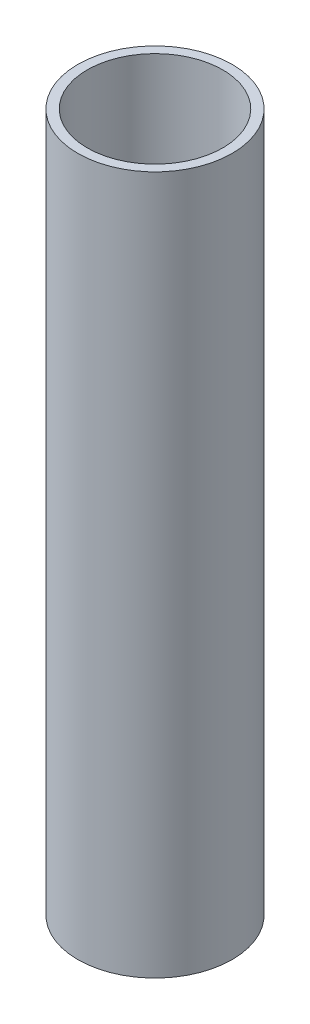
from build123d import *

# Parameters (mm, degrees)
SKETCH1_R           = 11.05
SKETCH1_R_2         = 9.7
BOSS_EXTRUDE1_DEPTH = 100


with BuildPart() as part:
    # Sketch1 → Boss-Extrude1 (new body)
    with BuildSketch(Plane(origin=(0, 0, 0), x_dir=(1, 0, 0), z_dir=(0, 1, 0))):
        with Locations(Location((0, 0, 0), (0, 0, 270))):
            Circle(SKETCH1_R)
        with Locations(Location((0, 0, 0), (0, 0, 270))):
            Circle(SKETCH1_R_2, mode=Mode.SUBTRACT)
    extrude(amount=BOSS_EXTRUDE1_DEPTH)


solid = part.part
